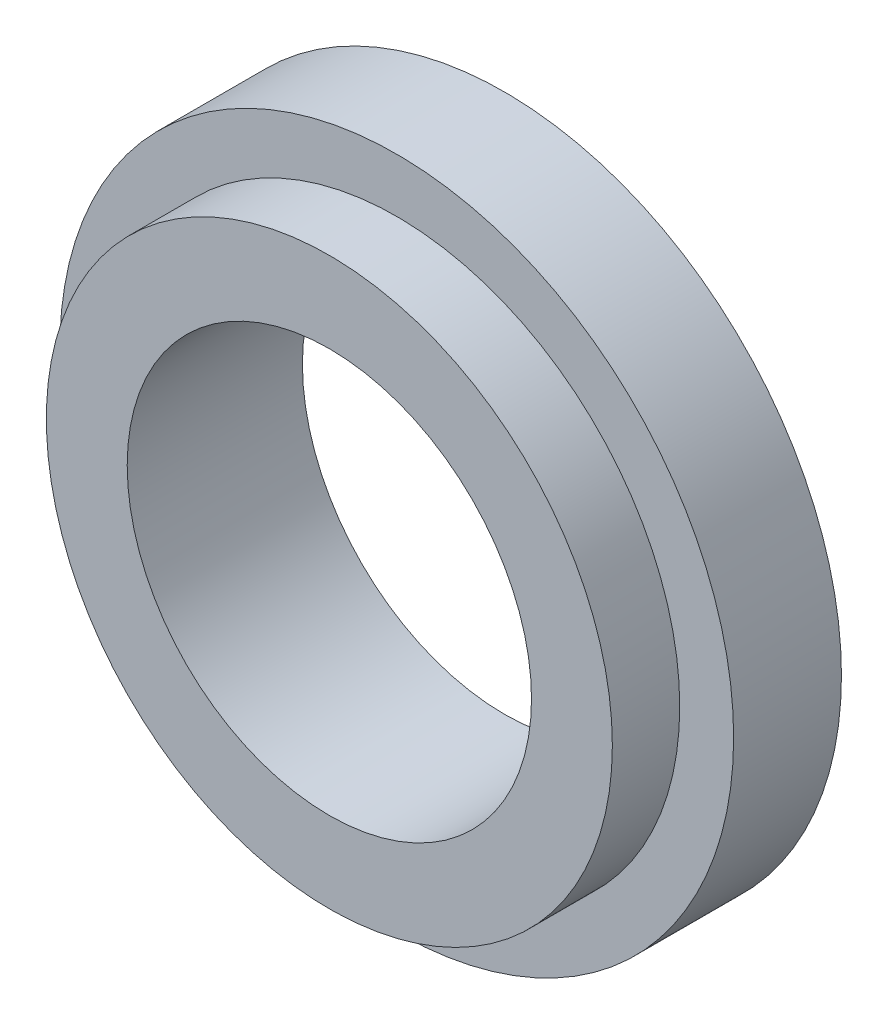
from build123d import *

# Parameters (mm, degrees)
SKETCH_1_R          = 25
EXTRUDE_1_DEPTH     = 8
SKETCH_2_R          = 21
EXTRUDE_2_DEPTH     = 5
SKETCH_3_R          = 15
CUT_EXTRUDE_1_DEPTH = 13


with BuildPart() as part:
    # 草图1 → 凸台-拉伸1 (new body)
    with BuildSketch(Plane.XY):
        Circle(SKETCH_1_R)
    extrude(amount=EXTRUDE_1_DEPTH)

    # 草图2 → 凸台-拉伸2 (add)
    with BuildSketch(Plane.XY.offset(8)):
        Circle(SKETCH_2_R)
    extrude(amount=EXTRUDE_2_DEPTH)

    # 草图3 → 切除-拉伸1 (cut)
    with BuildSketch(Plane.XY.offset(13)):
        Circle(SKETCH_3_R)
    extrude(amount=-CUT_EXTRUDE_1_DEPTH, mode=Mode.SUBTRACT)


solid = part.part
